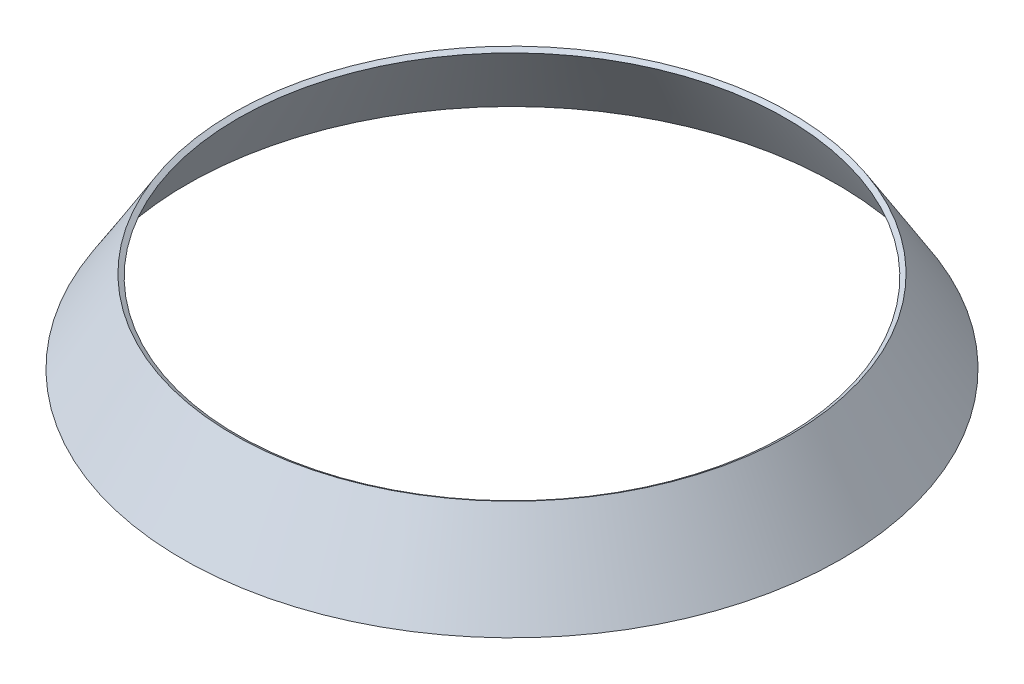
from build123d import *


with BuildPart() as part:
    # Sketch1 → Revolve1 (revolve)
    with BuildSketch(Plane.XY):
        Polygon((37.423396885, 5.714187289), (44.254528349, -5.346357133), (43.658960572, -5.714187289), (36.827829108, 5.346357133), align=None)
    revolve(axis=Axis((0, -1106.917829623, 0), (0, 1, 0)))


solid = part.part
